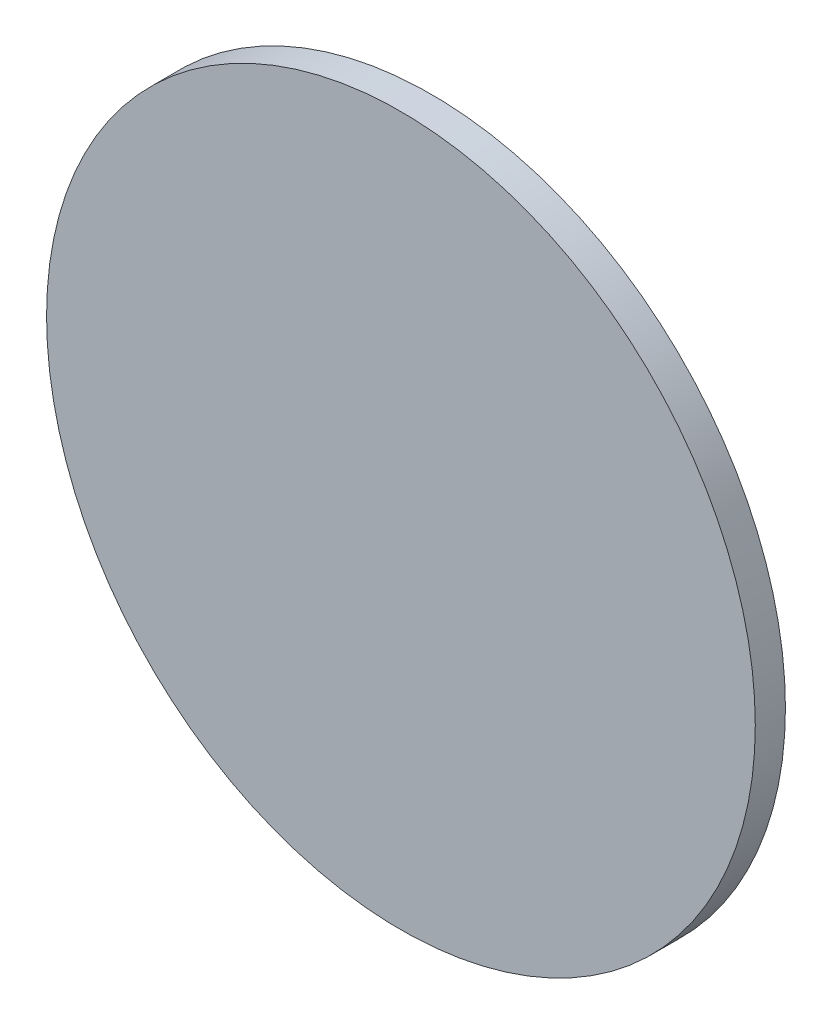
from build123d import *

# Parameters (mm, degrees)
SKETCH1_R           = 9.525
BOSS_EXTRUDE1_DEPTH = 0.81


with BuildPart() as part:
    # Sketch1 → Boss-Extrude1 (new body)
    with BuildSketch(Plane.XY):
        Circle(SKETCH1_R)
    extrude(amount=BOSS_EXTRUDE1_DEPTH)


solid = part.part
